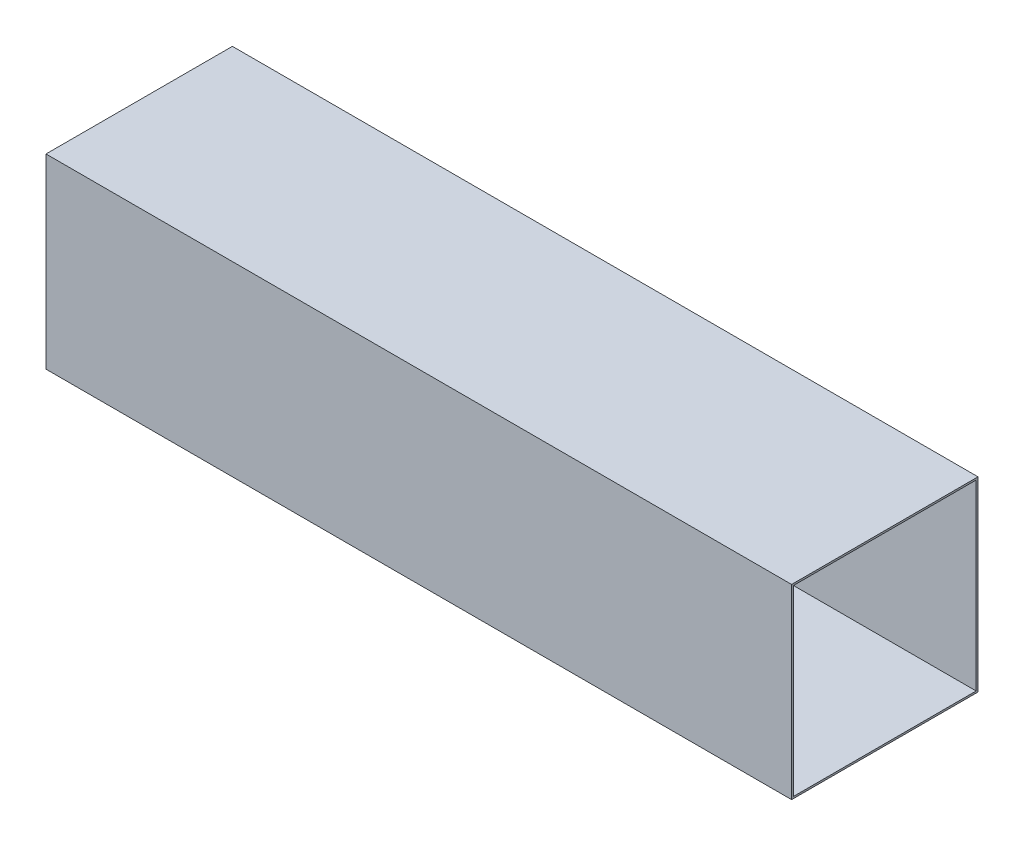
from build123d import *

# Parameters (mm, degrees)
SKETCH1_W           = 100
SKETCH1_H           = 100
SKETCH1_W_2         = 98
SKETCH1_H_2         = 98
BOSS_EXTRUDE1_DEPTH = 400


with BuildPart() as part:
    # Sketch1 → Boss-Extrude1 (new body)
    with BuildSketch(Plane(origin=(0, 0, 0), x_dir=(0, 0, -1), z_dir=(1, 0, 0))):
        with Locations((50, 50)):
            Rectangle(SKETCH1_W, SKETCH1_H)
        with Locations((50, 50)):
            Rectangle(SKETCH1_W_2, SKETCH1_H_2, mode=Mode.SUBTRACT)
    extrude(amount=BOSS_EXTRUDE1_DEPTH)


solid = part.part
